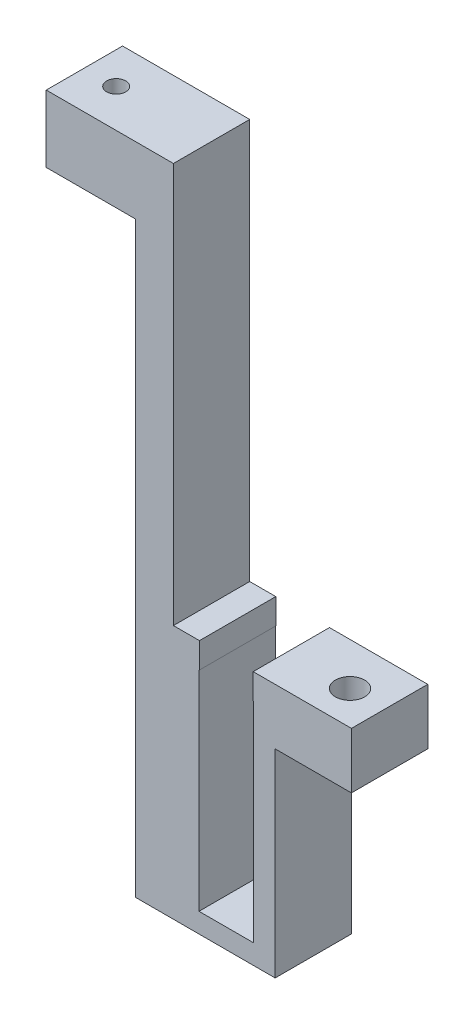
from build123d import *

# Parameters (mm, degrees)
SKETCH1_W           = 8
SKETCH1_H           = 20
BOSS_EXTRUDE1_DEPTH = 6
SKETCH2_W           = 4.289164283
SKETCH2_H           = 16.451556892
CUT_EXTRUDE1_DEPTH  = 10
CUT_EXTRUDE2_REACH  = 25.018
SKETCH3_W           = 4.222549804
SKETCH3_H           = 6
SKETCH4_W           = 6
SKETCH4_H           = 4.395289814
BOSS_EXTRUDE2_DEPTH = 3
SKETCH5_W           = 6
SKETCH5_H           = 51.469682585
BOSS_EXTRUDE3_DEPTH = 3
SKETCH6_W           = 6
SKETCH6_H           = 5.271956477
BOSS_EXTRUDE4_DEPTH = 7
SKETCH8_R           = 0.75
CUT_EXTRUDE3_DEPTH  = 56.431741569
SKETCH9_W           = 6
SKETCH9_H           = 4.395289814
BOSS_EXTRUDE5_DEPTH = 3
SKETCH10_R          = 1.15
CUT_EXTRUDE4_DEPTH  = 38.601737593


with BuildPart() as part:
    # Sketch1 → Boss-Extrude1 (new body)
    with BuildSketch(Plane.XY):
        with Locations((-5.686283245, 2.191356499)):
            Rectangle(SKETCH1_W, SKETCH1_H)
    extrude(amount=BOSS_EXTRUDE1_DEPTH)

    # Sketch2 → Cut-Extrude1 (cut)
    with BuildSketch(Plane.XY.offset(6)):
        with Locations((-5.530865387, 1.965578053)):
            Rectangle(SKETCH2_W, SKETCH2_H)
    extrude(amount=-CUT_EXTRUDE1_DEPTH, mode=Mode.SUBTRACT)

    # Sketch3 → Cut-Extrude2 (cut, up to next)
    with BuildSketch(Plane(origin=(0, 12.191356499, 0), x_dir=(1, 0, 0), z_dir=(0, 1, 0)), mode=Mode.PRIVATE) as cut_extrude2_sk1:
        with Locations((-5.525800627, -3)):
            Rectangle(SKETCH3_W, SKETCH3_H)
    cut_extrude2_tool1 = extrude(cut_extrude2_sk1.sketch, amount=-CUT_EXTRUDE2_REACH, mode=Mode.PRIVATE) & part.part
    add(cut_extrude2_tool1.solids().sort_by_distance((-5.525801, 12.191356, 3))[0], mode=Mode.SUBTRACT)

    # Sketch4 → Boss-Extrude2 (add)
    with BuildSketch(Plane(origin=(-1.686283245, 0, 0), x_dir=(0, 0, -1), z_dir=(1, 0, 0))):
        with Locations((-3, 9.993711592)):
            Rectangle(SKETCH4_W, SKETCH4_H)
    extrude(amount=BOSS_EXTRUDE2_DEPTH)

    # Sketch5 → Boss-Extrude3 (add)
    with BuildSketch(Plane.ZY.offset(9.686283245)):
        with Locations((3, 17.926197792)):
            Rectangle(SKETCH5_W, SKETCH5_H)
    extrude(amount=BOSS_EXTRUDE3_DEPTH)

    # Sketch6 → Boss-Extrude4 (add)
    with BuildSketch(Plane.ZY.offset(12.686283245)):
        with Locations((3, 41.025060846)):
            Rectangle(SKETCH6_W, SKETCH6_H)
    extrude(amount=BOSS_EXTRUDE4_DEPTH)

    # Sketch8 → Cut-Extrude3 (cut, through all)
    with BuildSketch(Plane(origin=(0, 43.661039084, 0), x_dir=(1, 0, 0), z_dir=(0, 1, 0))):
        with Locations(Location((-17.186283245, -3, 0), (0, 0, 180))):
            Circle(SKETCH8_R)
    extrude(amount=-CUT_EXTRUDE3_DEPTH, mode=Mode.SUBTRACT)

    # Sketch9 → Boss-Extrude5 (add)
    with BuildSketch(Plane(origin=(1.313716755, 0, 0), x_dir=(0, 0, -1), z_dir=(1, 0, 0))):
        with Locations((-3, 9.993711592)):
            Rectangle(SKETCH9_W, SKETCH9_H)
    extrude(amount=BOSS_EXTRUDE5_DEPTH)

    # Sketch10 → Cut-Extrude4 (cut, through all)
    with BuildSketch(Plane(origin=(0, 12.191356499, 0), x_dir=(1, 0, 0), z_dir=(0, 1, 0))):
        with Locations(Location((1.539504185, -3.336651143, 0), (0, 0, 270))):
            Circle(SKETCH10_R)
    extrude(amount=-CUT_EXTRUDE4_DEPTH, mode=Mode.SUBTRACT)


solid = part.part
